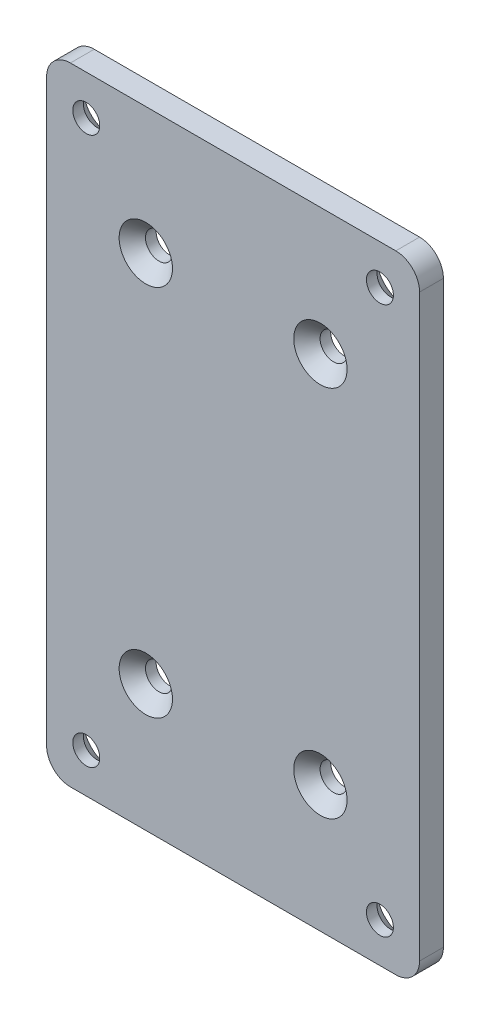
from build123d import *

# Parameters (mm, degrees)
SKETCH_1_W                 = 47
SKETCH_1_H                 = 79
EXTRUDE_1_DEPTH            = 3
HOLE_WIZARD_M31_AT_2_COUNT = 2
HOLE_WIZARD_M31_AT_2_PITCH = 22
HOLE_WIZARD_M31_AT_3_COUNT = 2
HOLE_WIZARD_M31_AT_3_PITCH = 47
HOLE_WIZARD_M31_AT_4_COUNT = 2
HOLE_WIZARD_M31_AT_4_PITCH = 51.894122981
HOLE_WIZARD_M32_AT_2_COUNT = 2
HOLE_WIZARD_M32_AT_2_PITCH = 37
HOLE_WIZARD_M32_AT_3_COUNT = 2
HOLE_WIZARD_M32_AT_3_PITCH = 69
HOLE_WIZARD_M32_AT_4_COUNT = 2
HOLE_WIZARD_M32_AT_4_PITCH = 78.294316524
FILLET_1_R                 = 3


with BuildPart() as part:
    # Эскиз1 → Бобышка-Вытянуть1 (new body)
    with BuildSketch(Plane.XY):
        Rectangle(SKETCH_1_W, SKETCH_1_H)
    extrude(amount=EXTRUDE_1_DEPTH)

    # Эскиз3 → Зенковка для  винта с потайной головкой с внутренним шестигранником M31 (revolve, cut)
    with BuildSketch(Plane(origin=(-11, 23.5, 3), x_dir=(0, -1, 0), z_dir=(1, 0, 0))):
        Polygon((0, 0), (0, 3), (1.7, 3), (1.7, 1.66), (3.36, 0), align=None)
    hole_wizard_m31 = revolve(axis=Axis((-11, 23.5, 9.35), (0, 0, -1)), mode=Mode.SUBTRACT)

    # Зенковка для  винта с потайной головкой с внутренним шестигранником M31 at 2: Зенковка для  винта с потайной головкой с внутренним шестигранником M31 ×2
    with Locations(*[(i * HOLE_WIZARD_M31_AT_2_PITCH, 0, 0) for i in range(1, HOLE_WIZARD_M31_AT_2_COUNT)]):
        add(hole_wizard_m31, mode=Mode.SUBTRACT)

    # Зенковка для  винта с потайной головкой с внутренним шестигранником M31 at 3: Зенковка для  винта с потайной головкой с внутренним шестигранником M31 ×2
    with Locations(*[(0, -i * HOLE_WIZARD_M31_AT_3_PITCH, 0) for i in range(1, HOLE_WIZARD_M31_AT_3_COUNT)]):
        add(hole_wizard_m31, mode=Mode.SUBTRACT)

    # Зенковка для  винта с потайной головкой с внутренним шестигранником M31 at 4: Зенковка для  винта с потайной головкой с внутренним шестигранником M31 ×2
    with Locations(*[Vector(0.42394010604863086, -0.9056902265584386, 0) * (i * HOLE_WIZARD_M31_AT_4_PITCH) for i in range(1, HOLE_WIZARD_M31_AT_4_COUNT)]):
        add(hole_wizard_m31, mode=Mode.SUBTRACT)

    # Эскиз6 → Зенковка для  винта с потайной головкой с внутренним шестигранником M32 (revolve, cut)
    with BuildSketch(Plane(origin=(18.5, 34.5, 0), x_dir=(0, 1, 0), z_dir=(1, 0, 0))):
        Polygon((0, 0), (0, 3), (1.7, 3), (1.7, 1.66), (3.36, 0), align=None)
    hole_wizard_m32 = revolve(axis=Axis((18.5, 34.5, -6.35), (0, 0, 1)), mode=Mode.SUBTRACT)

    # Зенковка для  винта с потайной головкой с внутренним шестигранником M32 at 2: Зенковка для  винта с потайной головкой с внутренним шестигранником M32 ×2
    with Locations(*[(-i * HOLE_WIZARD_M32_AT_2_PITCH, 0, 0) for i in range(1, HOLE_WIZARD_M32_AT_2_COUNT)]):
        add(hole_wizard_m32, mode=Mode.SUBTRACT)

    # Зенковка для  винта с потайной головкой с внутренним шестигранником M32 at 3: Зенковка для  винта с потайной головкой с внутренним шестигранником M32 ×2
    with Locations(*[(0, -i * HOLE_WIZARD_M32_AT_3_PITCH, 0) for i in range(1, HOLE_WIZARD_M32_AT_3_COUNT)]):
        add(hole_wizard_m32, mode=Mode.SUBTRACT)

    # Зенковка для  винта с потайной головкой с внутренним шестигранником M32 at 4: Зенковка для  винта с потайной головкой с внутренним шестигранником M32 ×2
    with Locations(*[Vector(-0.4725758093633575, -0.8812900228668016, 0) * (i * HOLE_WIZARD_M32_AT_4_PITCH) for i in range(1, HOLE_WIZARD_M32_AT_4_COUNT)]):
        add(hole_wizard_m32, mode=Mode.SUBTRACT)

    # Скругление1
    fillet_1_edges = [part.edges().sort_by_distance(p)[0] for p in [
        (23.5, -39.5, 1.5),
        (-23.5, -39.5, 1.5),
        (-23.5, 39.5, 1.5),
        (23.5, 39.5, 1.5),
    ]]
    fillet(fillet_1_edges, radius=FILLET_1_R)


solid = part.part
